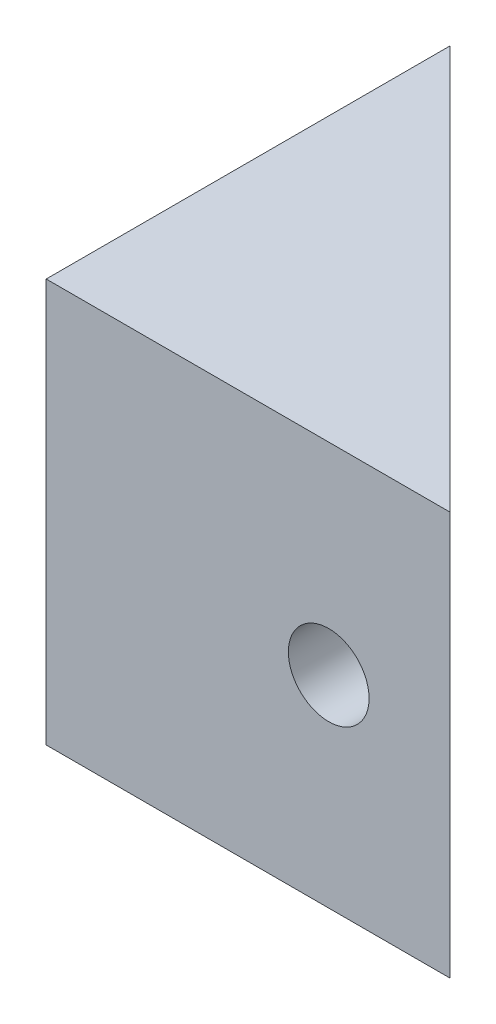
from build123d import *

# Parameters (mm, degrees)
BOSS_EXTRUDE1_DEPTH = 20
SKETCH2_R           = 2
CUT_EXTRUDE1_DEPTH  = 35.641016151


with BuildPart() as part:
    # Sketch1 → Boss-Extrude1 (new body)
    with BuildSketch(Plane(origin=(0, 0, 0), x_dir=(1, 0, 0), z_dir=(0, 1, 0))):
        Polygon((0, 20), (0, 0), (20, 0), align=None)
    extrude(amount=BOSS_EXTRUDE1_DEPTH)

    # Sketch2 → Cut-Extrude1 (cut, through all)
    with BuildSketch(Plane.XY):
        with Locations((14, 10)):
            Circle(SKETCH2_R)
    cut_extrude1 = extrude(amount=-CUT_EXTRUDE1_DEPTH, mode=Mode.SUBTRACT)

    # Mirror1: Cut-Extrude1 across plane
    add(cut_extrude1.mirror(Plane(origin=(0, 0, 0), x_dir=(-0.7071067811865475, 0, 0.7071067811865476), z_dir=(0.7071067811865478, 0, 0.7071067811865474))), mode=Mode.SUBTRACT)


solid = part.part
